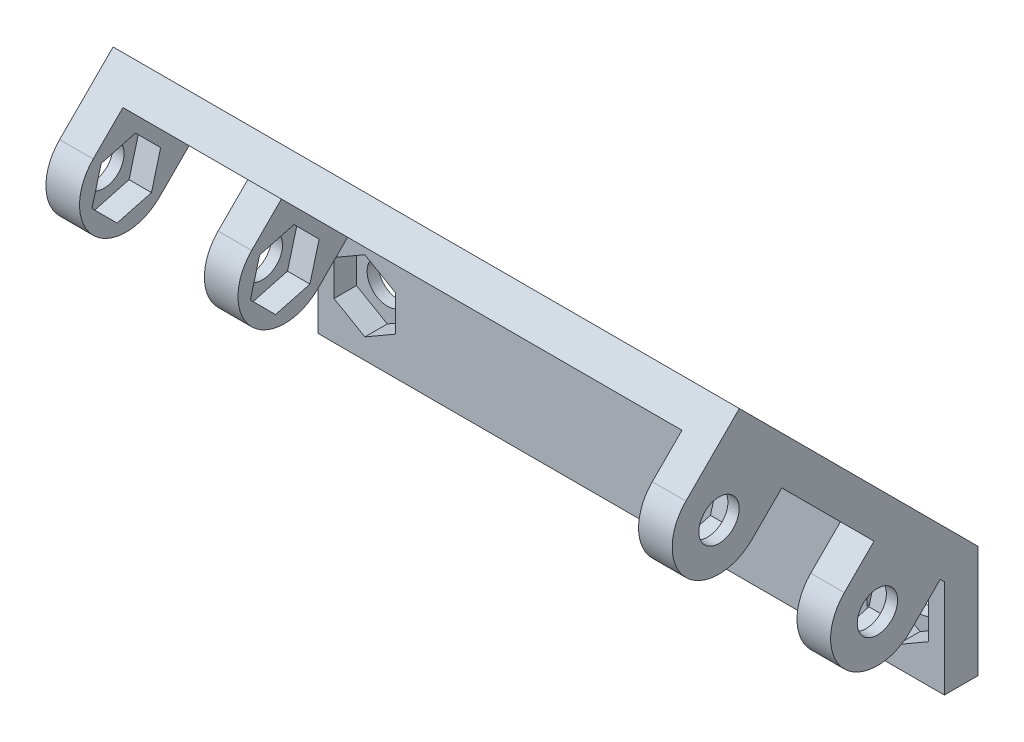
from build123d import *

# Parameters (mm, degrees)
SKETCH1_W            = 55.892639293
SKETCH1_H            = 10
BOSS_EXTRUDE1_DEPTH  = 3
CUT_EXTRUDE1_DEPTH   = 2
M3_CLEARANCE_HOLE1_D = 3.6
BOSS_EXTRUDE2_DEPTH  = 55.892639293
BOSS_EXTRUDE3_DEPTH  = 3
M3_CLEARANCE_HOLE2_D = 3.6
CUT_EXTRUDE2_START   = -3
CUT_EXTRUDE2_DEPTH   = 2
CUT_EXTRUDE3_START   = -52.892639
CUT_EXTRUDE3_DEPTH   = 2


with BuildPart() as part:
    # Sketch1 → Boss-Extrude1 (new body)
    with BuildSketch(Plane.XY):
        with Locations((42.125546196, -5)):
            Rectangle(SKETCH1_W, SKETCH1_H)
    extrude(amount=BOSS_EXTRUDE1_DEPTH)

    # Sketch2 → Cut-Extrude1 (cut)
    with BuildSketch(Plane.XY.offset(3)):
        Polygon((65.90105946, -8.175426481), (63.15105946, -6.58771324), (63.15105946, -3.41228676), (65.90105946, -1.824573519), (68.65105946, -3.41228676), (68.65105946, -6.58771324), align=None)
        Polygon((21.100032933, -6.58771324), (21.100032933, -3.41228676), (18.350032933, -1.824573519), (15.600032933, -3.41228676), (15.600032933, -6.58771324), (18.350032933, -8.175426481), align=None)
    extrude(amount=-CUT_EXTRUDE1_DEPTH, mode=Mode.SUBTRACT)

    # M3 Clearance Hole1 (through all)
    with Locations(Plane.XY.offset(3)):
        with Locations((18.350032933, -5), (65.90105946, -5)):
            Hole(M3_CLEARANCE_HOLE1_D / 2)

    # Sketch5 → Boss-Extrude2 (add)
    with BuildSketch(Plane.ZY.offset(-14.17922655)):
        Polygon((0, 0), (21.298989873, 21.298989873), (23.420310217, 19.17766953), (3, -1.242640687), (3, 0), align=None)
    extrude(amount=-BOSS_EXTRUDE2_DEPTH)

    # Sketch6 → Boss-Extrude3 (add)
    # profile 1 of 4: a face of its own
    with BuildSketch(Plane.ZY.offset(-14.17922655)):
        with BuildLine():
            Line((11.929825022, 2.383883477), (9.278174593, 5.035533906))
            Line((9.278174593, 5.035533906), (3.373229836, -0.869410851))
            Line((3.373229836, -0.869410851), (6.024880265, -3.521061281))
            ThreePointArc((6.024880265, -3.521061281), (11.929825022, -3.521061281), (11.929825022, 2.383883477))
        make_face()
        Polygon((6.731987046, -2.8139545), (5.910126197, 0.253271947), (8.155491794, 2.498637545), (11.222718241, 1.676776695), (12.044579091, -1.390449752), (9.799213493, -3.635815349), align=None, mode=Mode.SUBTRACT)
    # profile 2 of 4: a face of its own
    with BuildSketch(Plane.ZY.offset(-14.17922655)):
        Polygon((8.155491794, 2.498637545), (11.222718241, 1.676776695), (12.044579091, -1.390449752), (9.799213493, -3.635815349), (6.731987046, -2.8139545), (5.910126197, 0.253271947), align=None)
    # profile 3 of 4: a face of its own
    with BuildSketch(Plane.ZY.offset(-14.17922655)):
        with BuildLine():
            Line((26.071960646, 16.5260191), (23.420310217, 19.17766953))
            Line((23.420310217, 19.17766953), (17.515365459, 13.272724772))
            Line((17.515365459, 13.272724772), (20.167015889, 10.621074343))
            ThreePointArc((20.167015889, 10.621074343), (26.071960646, 10.621074343), (26.071960646, 16.5260191))
        make_face()
        Polygon((23.941349117, 10.506320274), (20.87412267, 11.328181124), (20.05226182, 14.395407571), (22.297627418, 16.640773169), (25.364853865, 15.818912319), (26.186714714, 12.751685872), align=None, mode=Mode.SUBTRACT)
    # profile 4 of 4: a face of its own
    with BuildSketch(Plane.ZY.offset(-14.17922655)):
        Polygon((22.297627418, 16.640773169), (20.05226182, 14.395407571), (20.87412267, 11.328181124), (23.941349117, 10.506320274), (26.186714714, 12.751685872), (25.364853865, 15.818912319), align=None)
    boss_extrude3 = extrude(amount=-BOSS_EXTRUDE3_DEPTH)

    # Mirror1: Boss-Extrude3 across plane
    add(boss_extrude3.mirror(Plane.ZY.offset(-42.125546197)))

    # M3 Clearance Hole2 (through all)
    with Locations(Plane.ZY.offset(-14.17922655)):
        with Locations((8.977352644, -0.568588902), (23.119488267, 13.573546722)):
            Hole(M3_CLEARANCE_HOLE2_D / 2)

    # Sketch6<3> → Cut-Extrude2 (cut)
    with BuildSketch(Plane.ZY.offset(-14.17922655).offset(CUT_EXTRUDE2_START)):
        Polygon((8.155491794, 2.498637545), (11.222718241, 1.676776695), (12.044579091, -1.390449752), (9.799213493, -3.635815349), (6.731987046, -2.8139545), (5.910126197, 0.253271947), align=None)
        Polygon((22.297627418, 16.640773169), (20.05226182, 14.395407571), (20.87412267, 11.328181124), (23.941349117, 10.506320274), (26.186714714, 12.751685872), (25.364853865, 15.818912319), align=None)
    extrude(amount=CUT_EXTRUDE2_DEPTH, mode=Mode.SUBTRACT)

    # Sketch6<4> → Cut-Extrude3 (cut)
    with BuildSketch(Plane.ZY.offset(-14.17922655).offset(CUT_EXTRUDE3_START)):
        Polygon((22.297627418, 16.640773169), (20.05226182, 14.395407571), (20.87412267, 11.328181124), (23.941349117, 10.506320274), (26.186714714, 12.751685872), (25.364853865, 15.818912319), align=None)
        Polygon((8.155491794, 2.498637545), (11.222718241, 1.676776695), (12.044579091, -1.390449752), (9.799213493, -3.635815349), (6.731987046, -2.8139545), (5.910126197, 0.253271947), align=None)
    extrude(amount=-CUT_EXTRUDE3_DEPTH, mode=Mode.SUBTRACT)


solid = part.part
